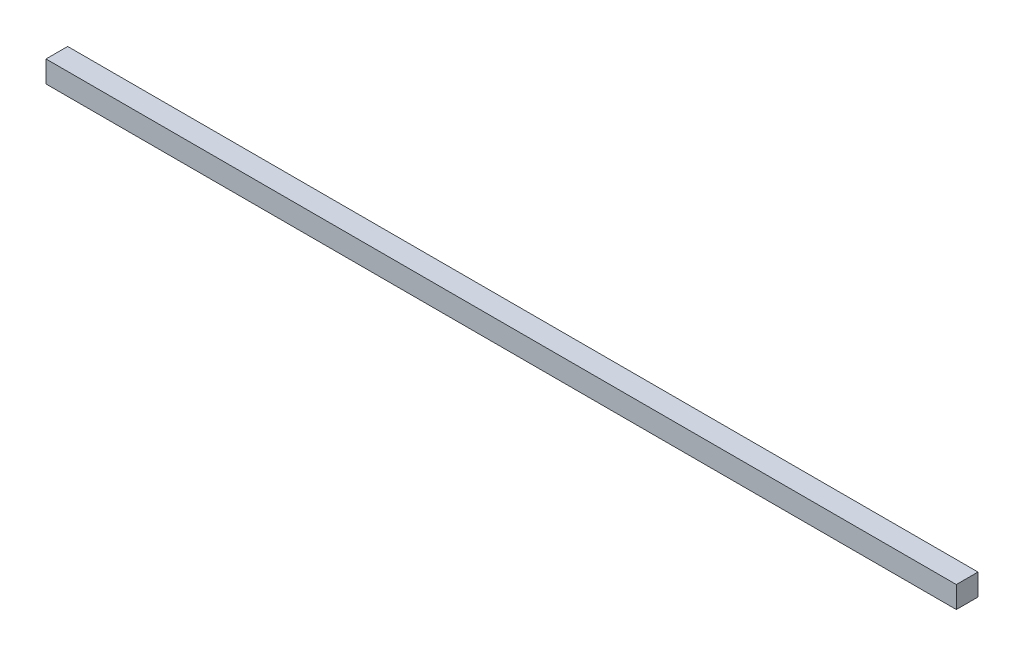
from build123d import *

# Parameters (mm, degrees)
SKETCH1_W           = 266.7
SKETCH1_H           = 6.35
BOSS_EXTRUDE1_DEPTH = 6.35


with BuildPart() as part:
    # Sketch1 → Boss-Extrude1 (new body)
    with BuildSketch(Plane(origin=(0, 0, 0), x_dir=(1, 0, 0), z_dir=(0, 1, 0))):
        with Locations((133.35, 3.175)):
            Rectangle(SKETCH1_W, SKETCH1_H)
    extrude(amount=BOSS_EXTRUDE1_DEPTH)


solid = part.part
